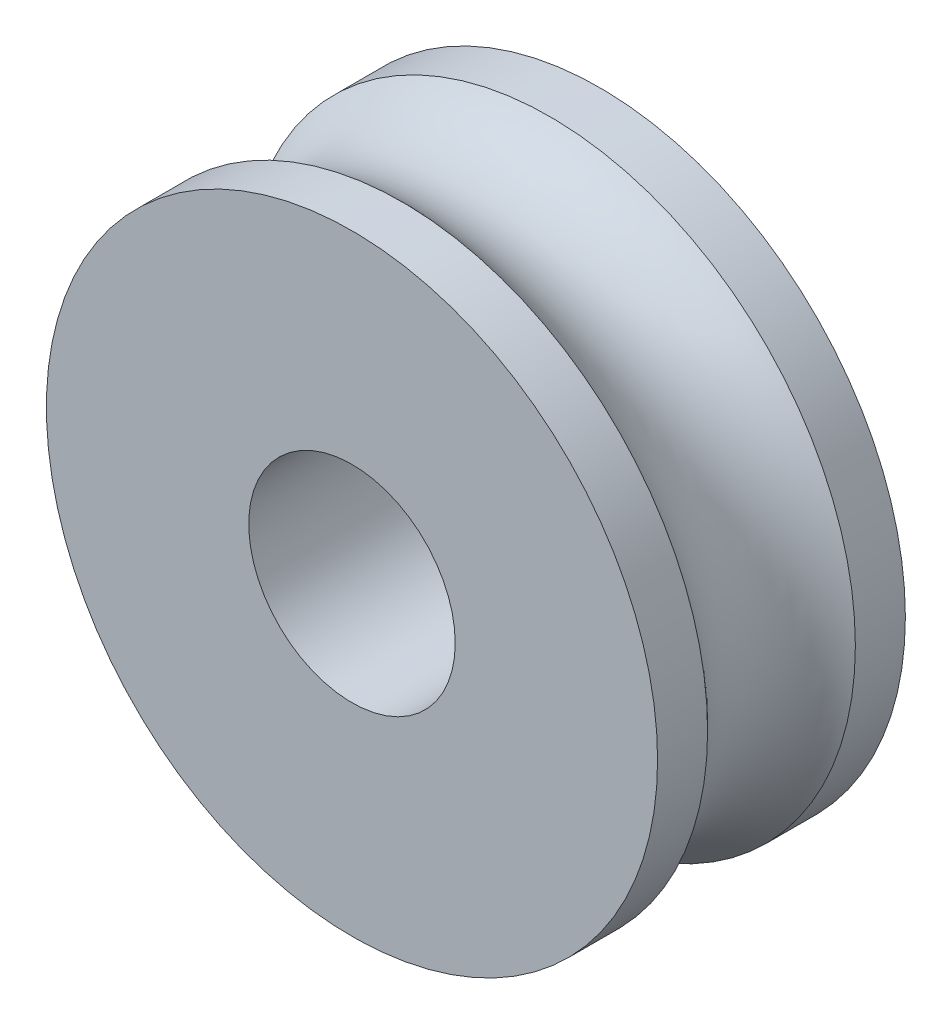
from build123d import *


with BuildPart() as part:
    # Sketch1 → Revolve1 (revolve)
    with BuildSketch(Plane(origin=(0, 0, 0), x_dir=(0, 0, -1), z_dir=(1, 0, 0)), mode=Mode.PRIVATE) as revolve1_sk:
        with BuildLine():
            Line((15, 12.5), (-15, 12.5))
            Line((-15, 12.5), (-15, 37))
            Line((-15, 37), (-8.94427191, 37))
            ThreePointArc((-8.94427191, 37), (0, 33), (8.94427191, 37))
            Line((8.94427191, 37), (15, 37))
            Line((15, 37), (15, 12.5))
        make_face()
    revolve(revolve1_sk.sketch.rotate(Axis((0, 0, 0), (0, 0, -1)), 90), axis=Axis((0, 0, 0), (0, 0, -1)))


solid = part.part
